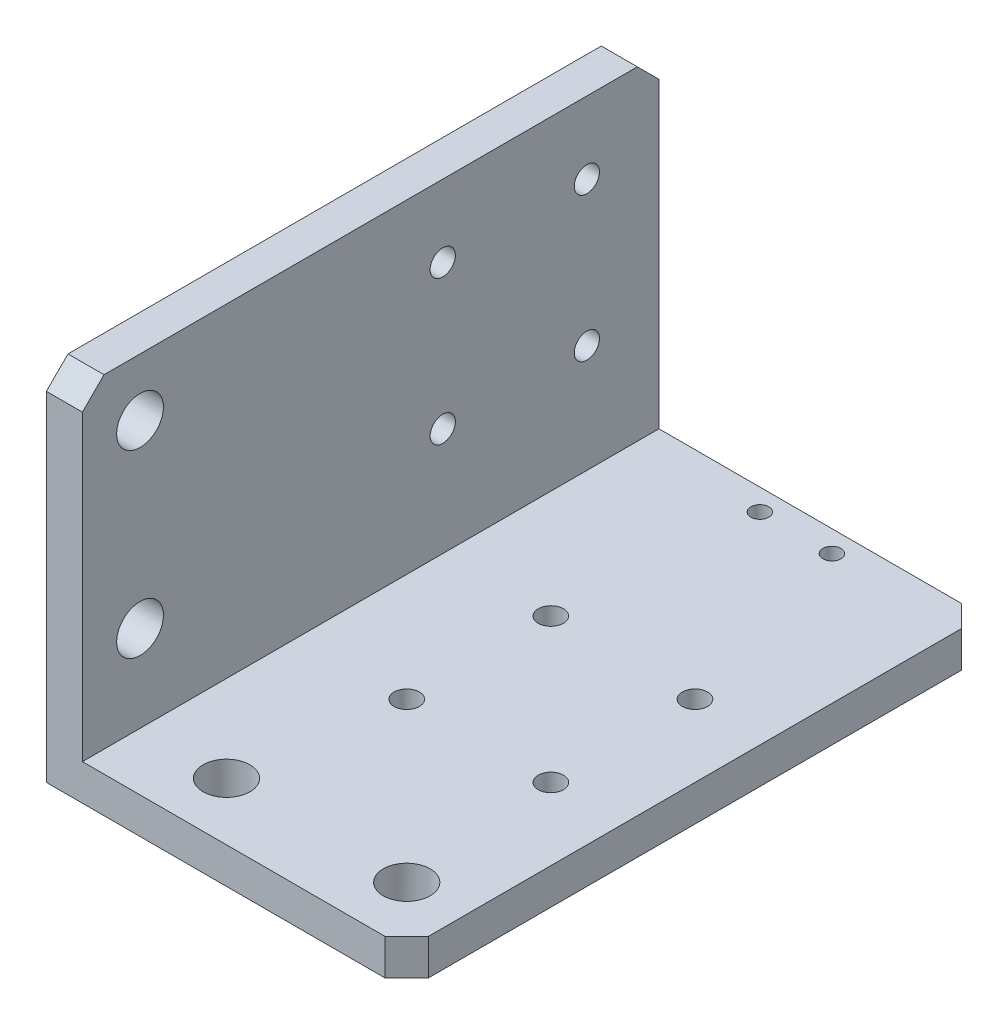
from build123d import *

# Parameters (mm, degrees)
ESTRUSIONE_ESTRUSIONE1_DEPTH = 80
FORO_6_5_6_5_1_D             = 6.5
FORO_6_5_6_5_2_D             = 6.5
FORO_6_5_6_5_2_DEPTH         = 5
FORO_6_5_6_5_2_TIP           = 1.952797012
TAGLIO_ESTRUSIONE3_REACH     = 108.771
SCHIZZO10_R                  = 1.75
TAGLIO_ESTRUSIONE4_REACH     = 108.771
SCHIZZO11_R                  = 1.75
SMUSSO1_SIZE                 = 3
TAGLIO_ESTRUSIONE5_REACH     = 106.523
SCHIZZO12_R                  = 1.25


with BuildPart() as part:
    # Schizzo1 → Estrusione-Estrusione1 (new body)
    with BuildSketch(Plane.XY):
        Polygon((0, 0), (0, 50), (5, 50), (5, 5), (50, 5), (50, 0), align=None)
    extrude(amount=ESTRUSIONE_ESTRUSIONE1_DEPTH)

    # Foro Ø6.5 (6.5)-1 (through all)
    with Locations(Plane(origin=(0, 0, 0), x_dir=(-1, 0, 0), z_dir=(0, -1, 0))):
        with Locations((-17, -72), (-42, -72)):
            Hole(FORO_6_5_6_5_1_D / 2)

    # Foro Ø6.5 (6.5)-2
    with Locations(Plane.ZY):
        with Locations((72, 42), (72, 17)):
            Hole(FORO_6_5_6_5_2_D / 2, depth=FORO_6_5_6_5_2_DEPTH)
            with Locations((0, 0, -(FORO_6_5_6_5_2_DEPTH + FORO_6_5_6_5_2_TIP / 2))):  # 118° drill point
                Cone(0, FORO_6_5_6_5_2_D / 2, FORO_6_5_6_5_2_TIP, mode=Mode.SUBTRACT)

    # Schizzo10 → Taglio-Estrusione3 (cut, up to next)
    with BuildSketch(Plane.ZY, mode=Mode.PRIVATE) as taglio_estrusione3_sk1:
        with Locations((10, 40)):
            Circle(SCHIZZO10_R)
    taglio_estrusione3_tool1 = extrude(taglio_estrusione3_sk1.sketch, amount=-TAGLIO_ESTRUSIONE3_REACH, mode=Mode.PRIVATE) & part.part
    # Schizzo10 → Taglio-Estrusione3 (cut, up to next)
    with BuildSketch(Plane.ZY, mode=Mode.PRIVATE) as taglio_estrusione3_sk2:
        with Locations((30, 40)):
            Circle(SCHIZZO10_R)
    taglio_estrusione3_tool2 = extrude(taglio_estrusione3_sk2.sketch, amount=-TAGLIO_ESTRUSIONE3_REACH, mode=Mode.PRIVATE) & part.part
    # Schizzo10 → Taglio-Estrusione3 (cut, up to next)
    with BuildSketch(Plane.ZY, mode=Mode.PRIVATE) as taglio_estrusione3_sk3:
        with Locations((30, 20)):
            Circle(SCHIZZO10_R)
    taglio_estrusione3_tool3 = extrude(taglio_estrusione3_sk3.sketch, amount=-TAGLIO_ESTRUSIONE3_REACH, mode=Mode.PRIVATE) & part.part
    # Schizzo10 → Taglio-Estrusione3 (cut, up to next)
    with BuildSketch(Plane.ZY, mode=Mode.PRIVATE) as taglio_estrusione3_sk4:
        with Locations((10, 20)):
            Circle(SCHIZZO10_R)
    taglio_estrusione3_tool4 = extrude(taglio_estrusione3_sk4.sketch, amount=-TAGLIO_ESTRUSIONE3_REACH, mode=Mode.PRIVATE) & part.part
    add(taglio_estrusione3_tool1.solids().sort_by_distance((0, 40, 10))[0], mode=Mode.SUBTRACT)
    add(taglio_estrusione3_tool2.solids().sort_by_distance((0, 40, 30))[0], mode=Mode.SUBTRACT)
    add(taglio_estrusione3_tool3.solids().sort_by_distance((0, 20, 30))[0], mode=Mode.SUBTRACT)
    add(taglio_estrusione3_tool4.solids().sort_by_distance((0, 20, 10))[0], mode=Mode.SUBTRACT)

    # Schizzo11 → Taglio-Estrusione4 (cut, up to next)
    with BuildSketch(Plane.XZ, mode=Mode.PRIVATE) as taglio_estrusione4_sk1:
        with Locations((20, 30)):
            Circle(SCHIZZO11_R)
    taglio_estrusione4_tool1 = extrude(taglio_estrusione4_sk1.sketch, amount=-TAGLIO_ESTRUSIONE4_REACH, mode=Mode.PRIVATE) & part.part
    # Schizzo11 → Taglio-Estrusione4 (cut, up to next)
    with BuildSketch(Plane.XZ, mode=Mode.PRIVATE) as taglio_estrusione4_sk2:
        with Locations((20, 50)):
            Circle(SCHIZZO11_R)
    taglio_estrusione4_tool2 = extrude(taglio_estrusione4_sk2.sketch, amount=-TAGLIO_ESTRUSIONE4_REACH, mode=Mode.PRIVATE) & part.part
    # Schizzo11 → Taglio-Estrusione4 (cut, up to next)
    with BuildSketch(Plane.XZ, mode=Mode.PRIVATE) as taglio_estrusione4_sk3:
        with Locations((40, 50)):
            Circle(SCHIZZO11_R)
    taglio_estrusione4_tool3 = extrude(taglio_estrusione4_sk3.sketch, amount=-TAGLIO_ESTRUSIONE4_REACH, mode=Mode.PRIVATE) & part.part
    # Schizzo11 → Taglio-Estrusione4 (cut, up to next)
    with BuildSketch(Plane.XZ, mode=Mode.PRIVATE) as taglio_estrusione4_sk4:
        with Locations((40, 30)):
            Circle(SCHIZZO11_R)
    taglio_estrusione4_tool4 = extrude(taglio_estrusione4_sk4.sketch, amount=-TAGLIO_ESTRUSIONE4_REACH, mode=Mode.PRIVATE) & part.part
    add(taglio_estrusione4_tool1.solids().sort_by_distance((20, 0, 30))[0], mode=Mode.SUBTRACT)
    add(taglio_estrusione4_tool2.solids().sort_by_distance((20, 0, 50))[0], mode=Mode.SUBTRACT)
    add(taglio_estrusione4_tool3.solids().sort_by_distance((40, 0, 50))[0], mode=Mode.SUBTRACT)
    add(taglio_estrusione4_tool4.solids().sort_by_distance((40, 0, 30))[0], mode=Mode.SUBTRACT)

    # Smusso1
    smusso1_edges = [part.edges().sort_by_distance(p)[0] for p in [
        (2.5, 50, 80),
        (2.5, 50, 0),
        (50, 2.5, 80),
        (50, 2.5, 0),
    ]]
    chamfer(smusso1_edges, length=SMUSSO1_SIZE)

    # Schizzo12 → Taglio-Estrusione5 (cut, up to next)
    with BuildSketch(Plane(origin=(0, 5, 0), x_dir=(1, 0, 0), z_dir=(0, 1, 0)), mode=Mode.PRIVATE) as taglio_estrusione5_sk1:
        with Locations(Location((32, -3, 0), (0, 0, 180))):
            Circle(SCHIZZO12_R)
    taglio_estrusione5_tool1 = extrude(taglio_estrusione5_sk1.sketch, amount=-TAGLIO_ESTRUSIONE5_REACH, mode=Mode.PRIVATE) & part.part
    # Schizzo12 → Taglio-Estrusione5 (cut, up to next)
    with BuildSketch(Plane(origin=(0, 5, 0), x_dir=(1, 0, 0), z_dir=(0, 1, 0)), mode=Mode.PRIVATE) as taglio_estrusione5_sk2:
        with Locations(Location((22, -3, 0), (0, 0, 180))):
            Circle(SCHIZZO12_R)
    taglio_estrusione5_tool2 = extrude(taglio_estrusione5_sk2.sketch, amount=-TAGLIO_ESTRUSIONE5_REACH, mode=Mode.PRIVATE) & part.part
    add(taglio_estrusione5_tool1.solids().sort_by_distance((32, 5, 3))[0], mode=Mode.SUBTRACT)
    add(taglio_estrusione5_tool2.solids().sort_by_distance((22, 5, 3))[0], mode=Mode.SUBTRACT)


solid = part.part
